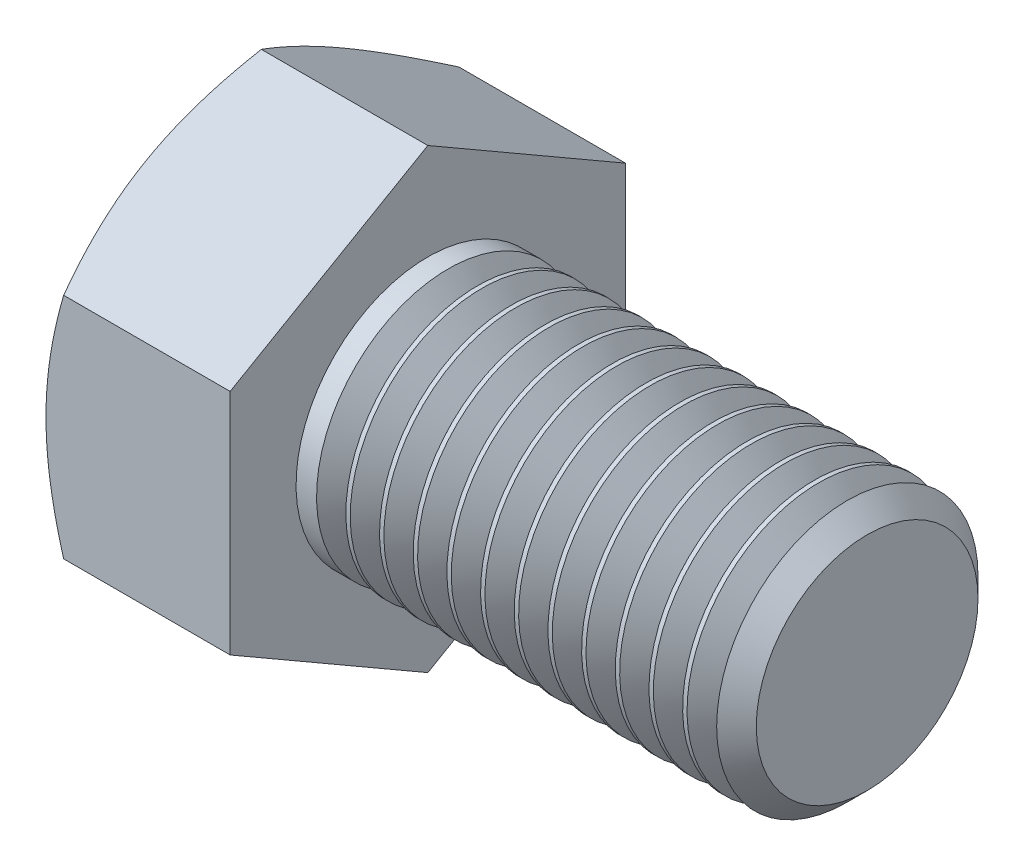
from build123d import *

# Parameters (mm, degrees)
BASEHEAD_DEPTH  = 13.3096
THDSCHPAT_COUNT = 12
THDSCHPAT_PITCH = 2.434166667


with BuildPart() as part:
    # Sketch1 → BaseHead (new body)
    with BuildSketch(Plane(origin=(0, 0, 0), x_dir=(0, 0, -1), z_dir=(1, 0, 0))):
        Polygon((14.2875, 8.248891971), (14.2875, -8.248891971), (0, -16.497783942), (-14.2875, -8.248891971), (-14.2875, 8.248891971), (0, 16.497783942), align=None)
    extrude(amount=BASEHEAD_DEPTH)

    # BodySke → BaseBody (revolve)
    with BuildSketch(Plane.XY, mode=Mode.PRIVATE) as basebody_sk:
        Polygon((0, 0), (45.0596, 0), (45.0596, 8.01243), (43.54703, 9.525), (0, 9.525), align=None)
    revolve(basebody_sk.sketch.rotate(Axis((0, 0, 0), (1, 0, 0)), 90), axis=Axis((0, 0, 0), (1, 0, 0)))

    # Sketch3 → HeadChamfer (revolve, cut)
    with BuildSketch(Plane.XY):
        Polygon((0, 14.2875), (4.942282238, 22.847783942), (4.942282238, 29.197783942), (-12.7, 29.197783942), (-12.7, 14.2875), align=None)
    revolve(axis=Axis((0, 0, 0), (1, 0, 0)), mode=Mode.SUBTRACT)

    # ThdSchSke → ThreadSchematic (revolve, cut)
    with BuildSketch(Plane.XY):
        Polygon((15.8496, -8.01243), (14.790487084, -9.525), (14.790487084, -11.90625), (16.908712916, -11.90625), (16.908712916, -9.525), align=None)
    threadschematic = revolve(axis=Axis((-3.175, 0, 0), (1, 0, 0)), mode=Mode.SUBTRACT)

    # ThdSchPat: ThreadSchematic ×12
    with Locations(*[(i * THDSCHPAT_PITCH, 0, 0) for i in range(1, THDSCHPAT_COUNT)]):
        add(threadschematic, mode=Mode.SUBTRACT)


solid = part.part
